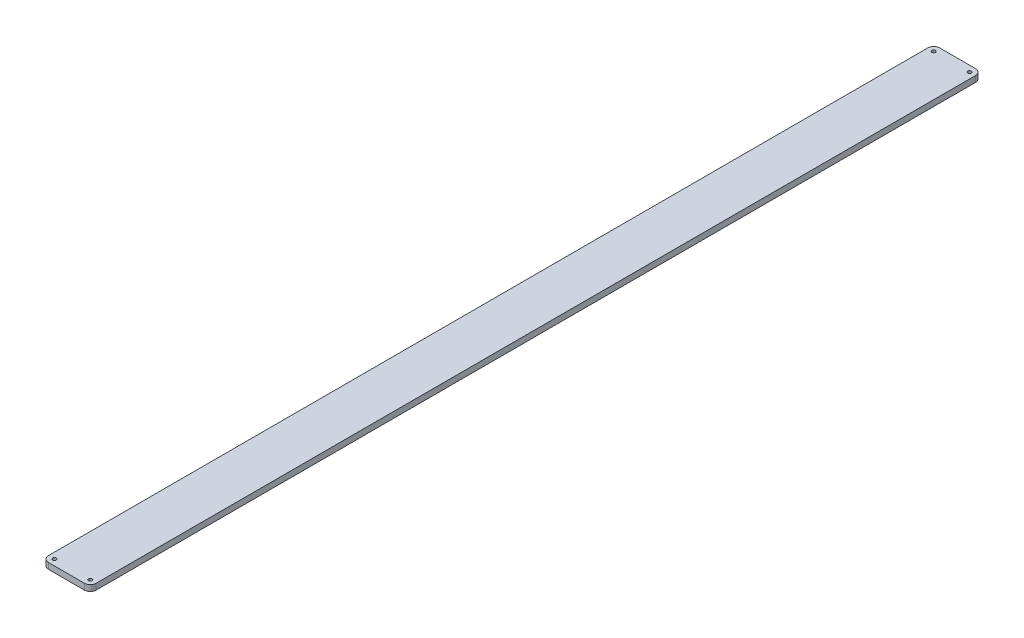
from build123d import *

# Parameters (mm, degrees)
SKETCH_1_W      = 40
SKETCH_1_H      = 746
SKETCH_1_R      = 1.5
EXTRUDE_1_DEPTH = 5
FILLET_1_R      = 5


with BuildPart() as part:
    # ｽｹｯﾁ1 → ﾎﾞｽ - 押し出し1 (new body)
    with BuildSketch(Plane(origin=(0, 0, 0), x_dir=(1, 0, 0), z_dir=(0, 1, 0))):
        Rectangle(SKETCH_1_W, SKETCH_1_H)
        with Locations(Location((15, 368, 0), (0, 0, 270))):
            Circle(SKETCH_1_R, mode=Mode.SUBTRACT)
        with Locations(Location((-15, 368, 0), (0, 0, 90))):
            Circle(SKETCH_1_R, mode=Mode.SUBTRACT)
        with Locations(Location((-15, -368, 0), (0, 0, 270))):
            Circle(SKETCH_1_R, mode=Mode.SUBTRACT)
        with Locations(Location((15, -368, 0), (0, 0, 90))):
            Circle(SKETCH_1_R, mode=Mode.SUBTRACT)
    extrude(amount=EXTRUDE_1_DEPTH)

    # ﾌｨﾚｯﾄ1
    fillet_1_edges = [part.edges().sort_by_distance(p)[0] for p in [
        (20, 2.5, 373),
        (-20, 2.5, 373),
        (-20, 2.5, -373),
        (20, 2.5, -373),
    ]]
    fillet(fillet_1_edges, radius=FILLET_1_R)


solid = part.part
